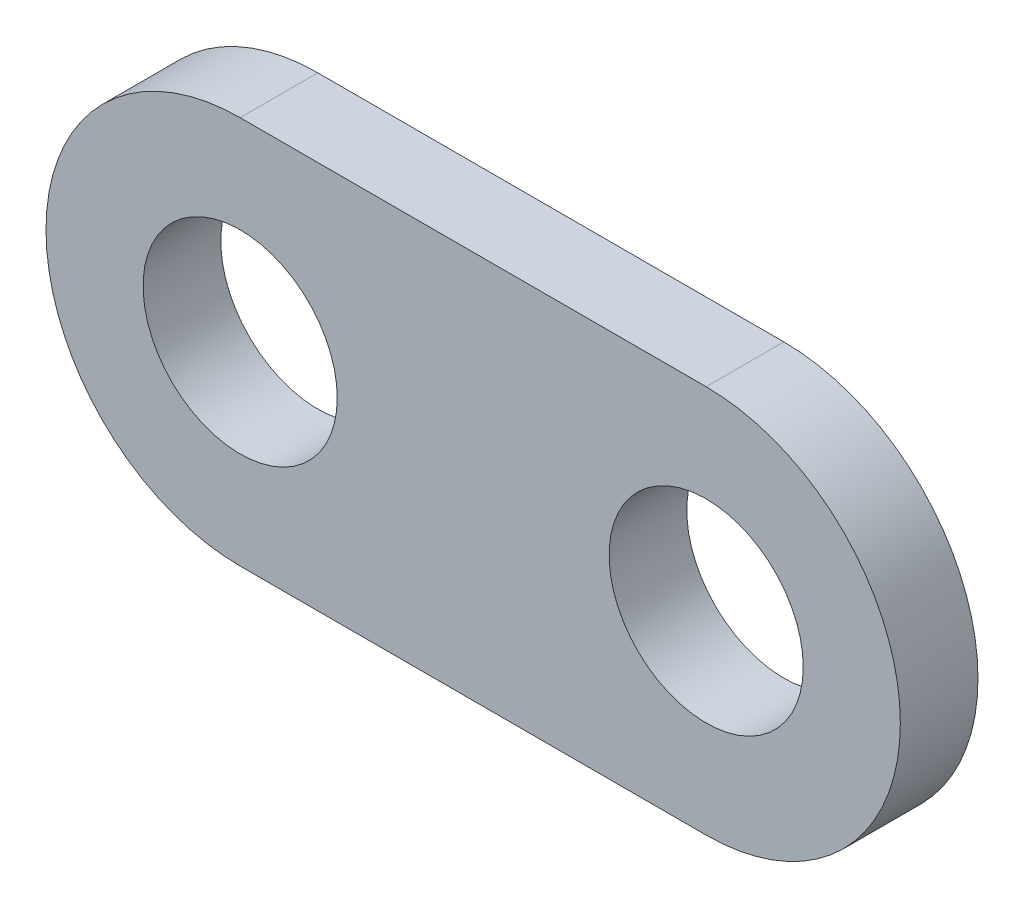
from build123d import *

# Parameters (mm, degrees)
ESQUISSE1_R          = 5
BASE_EXTRUSION_DEPTH = 2


with BuildPart() as part:
    # Esquisse1 → Base-Extrusion (new, symmetric)
    with BuildSketch(Plane.XY):
        with BuildLine():
            Line((0, 10), (24, 10))
            ThreePointArc((24, 10), (34, 0), (24, -10))
            Line((24, -10), (0, -10))
            ThreePointArc((0, -10), (-10, 0), (0, 10))
        make_face()
        Circle(ESQUISSE1_R, mode=Mode.SUBTRACT)
        with Locations((24, 0)):
            Circle(ESQUISSE1_R, mode=Mode.SUBTRACT)
    extrude(amount=BASE_EXTRUSION_DEPTH, both=True)


solid = part.part
